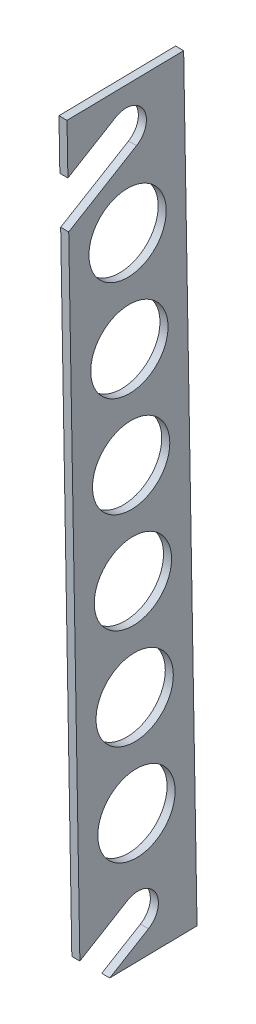
from build123d import *

# Parameters (mm, degrees)
SKETCH1_R           = 7.62
BOSS_EXTRUDE1_DEPTH = 1.5875


with BuildPart() as part:
    # Sketch1 → Boss-Extrude1 (new body)
    with BuildSketch(Plane(origin=(0, 0, 0), x_dir=(0, 0, -1), z_dir=(1, 0, 0))):
        with BuildLine():
            Line((-12.642487664, 65.178590664), (-12.468624959, 55.244460434))
            Line((-12.468624959, 55.244460434), (-3.075732618, 60.888873679))
            ThreePointArc((-3.075732618, 60.888873679), (2.439979404, 59.513924484), (1.065030209, 53.998212461))
            Line((1.065030209, 53.998212461), (-12.306187241, 45.963128683))
            Line((-12.306187241, 45.963128683), (-10.108033982, -79.634484144))
            Line((-10.108033982, -79.634484144), (-0.715141642, -73.990070899))
            ThreePointArc((-0.715141642, -73.990070899), (4.800570381, -75.365020094), (3.425621185, -80.880732117))
            Line((3.425621185, -80.880732117), (-4.214042055, -85.47158814))
            Line((-4.214042055, -85.47158814), (12.992376231, -85.170449101))
            Line((12.992376231, -85.170449101), (10.353990645, 65.581064744))
            Line((10.353990645, 65.581064744), (-12.642487664, 65.178590664))
        make_face()
        with Locations((-0.699777134, 39.983716876)):
            Circle(SKETCH1_R, mode=Mode.SUBTRACT)
        with Locations((-0.349888567, 19.991858438)):
            Circle(SKETCH1_R, mode=Mode.SUBTRACT)
        Circle(SKETCH1_R, mode=Mode.SUBTRACT)
        with Locations((0.349888567, -19.991858438)):
            Circle(SKETCH1_R, mode=Mode.SUBTRACT)
        with Locations((0.699777134, -39.983716876)):
            Circle(SKETCH1_R, mode=Mode.SUBTRACT)
        with Locations((1.049665701, -59.975575313)):
            Circle(SKETCH1_R, mode=Mode.SUBTRACT)
    extrude(amount=BOSS_EXTRUDE1_DEPTH)


solid = part.part
